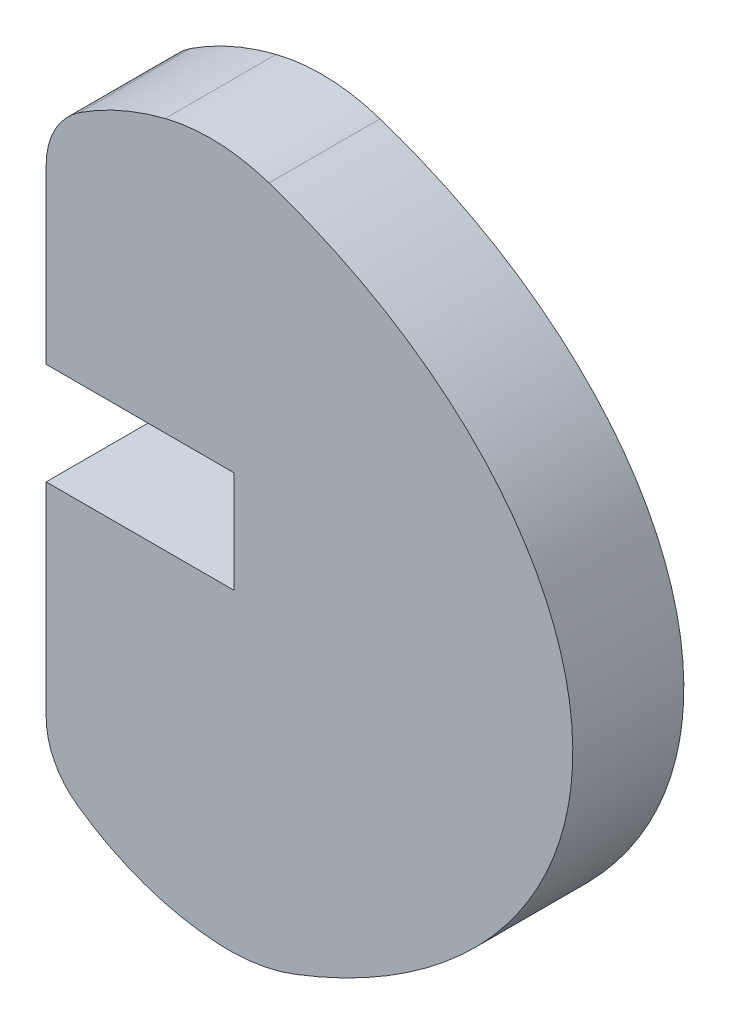
from build123d import *

# Parameters (mm, degrees)
SALIENTE_EXTRUIR1_DEPTH = 3


with BuildPart() as part:
    # Croquis1 → Saliente-Extruir1 (new body)
    with BuildSketch(Plane.XY):
        with BuildLine():
            Line((-144.434437963, 23.831289655), (-139.359958663, 23.831289655))
            Line((-139.359958663, 23.831289655), (-139.359958663, 21.081289655))
            Line((-139.359958663, 21.081289655), (-144.434437963, 21.081289655))
            Line((-144.434437963, 21.081289655), (-144.434437963, 15.568266464))
            ThreePointArc((-144.434437963, 15.568266464), (-144.212105673, 14.651807238), (-143.59454045, 13.93910649))
            ThreePointArc((-143.59454045, 13.93910649), (-141.78704859, 13.000742202), (-139.79067514, 12.598191072))
            ThreePointArc((-139.79067514, 12.598191072), (-138.731334246, 12.648248724), (-137.706379935, 12.920604299))
            add(Edge.make_bspline(
                [(-137.706379935, 12.920604299), (-112.690499862, 22.507679551), (-138.413124465, 31.087686647)],
                knots=[5.204835954, 5.204835954, 5.204835954, 7.417095332, 7.417095332, 7.417095332], degree=2, weights=[1, 0.44812481, 1]))
            ThreePointArc((-138.413124465, 31.087686647), (-139.809326003, 31.341133977), (-141.220500745, 31.192136898))
            ThreePointArc((-141.220500745, 31.192136898), (-142.419935003, 30.779687584), (-143.533969481, 30.173317932))
            ThreePointArc((-143.533969481, 30.173317932), (-144.194986604, 29.451610375), (-144.434437963, 28.502680197))
            Line((-144.434437963, 28.502680197), (-144.434437963, 23.831289655))
        make_face()
    extrude(amount=SALIENTE_EXTRUIR1_DEPTH)


solid = part.part
